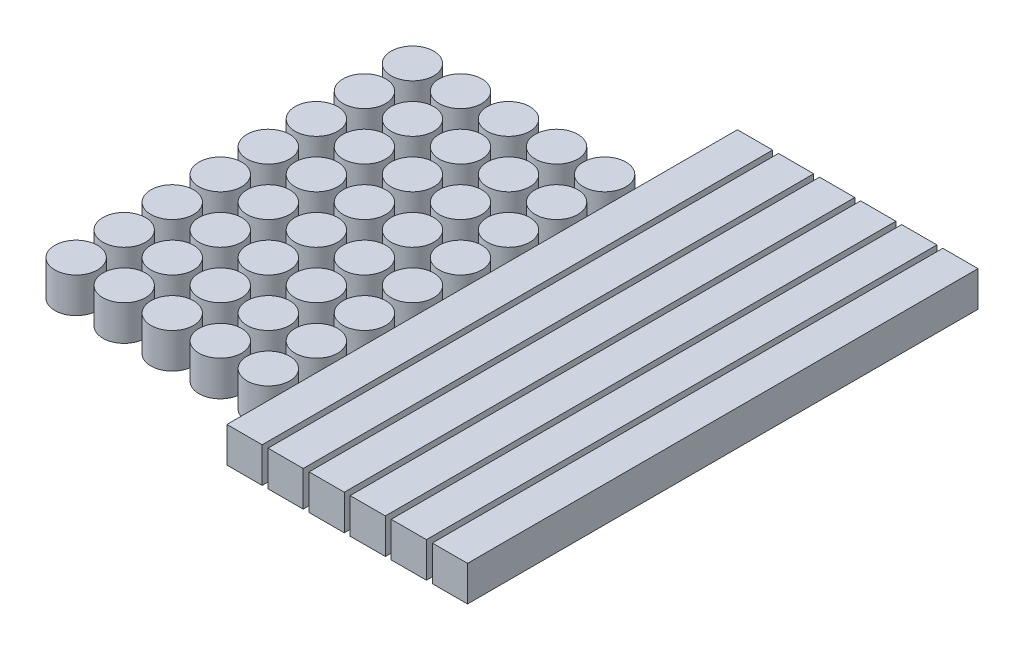
from build123d import *

# Parameters (mm, degrees)
ESBO_O1_R                   = 3.63881204
RESSALTO_EXTRUS_O1_DEPTH    = 6
RESSALTO_EXTRUS_O1_2_DEPTH  = 6
RESSALTO_EXTRUS_O1_3_DEPTH  = 6
RESSALTO_EXTRUS_O1_4_DEPTH  = 6
RESSALTO_EXTRUS_O1_5_DEPTH  = 6
RESSALTO_EXTRUS_O1_6_DEPTH  = 6
RESSALTO_EXTRUS_O1_7_DEPTH  = 6
RESSALTO_EXTRUS_O1_8_DEPTH  = 6
RESSALTO_EXTRUS_O1_9_DEPTH  = 6
RESSALTO_EXTRUS_O1_10_DEPTH = 6
RESSALTO_EXTRUS_O1_11_DEPTH = 6
RESSALTO_EXTRUS_O1_12_DEPTH = 6
RESSALTO_EXTRUS_O1_13_DEPTH = 6
RESSALTO_EXTRUS_O1_14_DEPTH = 6
RESSALTO_EXTRUS_O1_15_DEPTH = 6
RESSALTO_EXTRUS_O1_16_DEPTH = 6
RESSALTO_EXTRUS_O1_17_DEPTH = 6
RESSALTO_EXTRUS_O1_18_DEPTH = 6
RESSALTO_EXTRUS_O1_19_DEPTH = 6
RESSALTO_EXTRUS_O1_20_DEPTH = 6
RESSALTO_EXTRUS_O1_21_DEPTH = 6
RESSALTO_EXTRUS_O1_22_DEPTH = 6
RESSALTO_EXTRUS_O1_23_DEPTH = 6
RESSALTO_EXTRUS_O1_24_DEPTH = 6
RESSALTO_EXTRUS_O1_25_DEPTH = 6
RESSALTO_EXTRUS_O1_26_DEPTH = 6
RESSALTO_EXTRUS_O1_27_DEPTH = 6
RESSALTO_EXTRUS_O1_28_DEPTH = 6
RESSALTO_EXTRUS_O1_29_DEPTH = 6
RESSALTO_EXTRUS_O1_30_DEPTH = 6
RESSALTO_EXTRUS_O1_31_DEPTH = 6
RESSALTO_EXTRUS_O1_32_DEPTH = 6
RESSALTO_EXTRUS_O1_33_DEPTH = 6
RESSALTO_EXTRUS_O1_34_DEPTH = 6
RESSALTO_EXTRUS_O1_35_DEPTH = 6
RESSALTO_EXTRUS_O1_36_DEPTH = 6
RESSALTO_EXTRUS_O1_37_DEPTH = 6
RESSALTO_EXTRUS_O1_38_DEPTH = 6
RESSALTO_EXTRUS_O1_39_DEPTH = 6
RESSALTO_EXTRUS_O1_40_DEPTH = 6
ESBO_O1_W                   = 6
ESBO_O1_H                   = 87
RESSALTO_EXTRUS_O1_41_DEPTH = 6
RESSALTO_EXTRUS_O1_42_DEPTH = 6
RESSALTO_EXTRUS_O1_43_DEPTH = 6
RESSALTO_EXTRUS_O1_44_DEPTH = 6
RESSALTO_EXTRUS_O1_45_DEPTH = 6
RESSALTO_EXTRUS_O1_46_DEPTH = 6


with BuildPart() as part:
    # Esboço1 → Ressalto-extrusão1 (new body)
    with BuildSketch(Plane(origin=(0, 0, 0), x_dir=(1, 0, 0), z_dir=(0, 1, 0))):
        with Locations(Location((-30.842256069, 16.789591759, 0), (0, 0, 270))):
            Circle(ESBO_O1_R)
    extrude(amount=RESSALTO_EXTRUS_O1_DEPTH)


with BuildPart() as body_2:
    # Esboço1 → Ressalto-extrus_o1 2 (new body)
    with BuildSketch(Plane(origin=(0, 0, 0), x_dir=(1, 0, 0), z_dir=(0, 1, 0))):
        with Locations(Location((-22.654928979, 16.789591759, 0), (0, 0, 270))):
            Circle(ESBO_O1_R)
    extrude(amount=RESSALTO_EXTRUS_O1_2_DEPTH)


with BuildPart() as body_3:
    # Esboço1 → Ressalto-extrus_o1 3 (new body)
    with BuildSketch(Plane(origin=(0, 0, 0), x_dir=(1, 0, 0), z_dir=(0, 1, 0))):
        with Locations(Location((-14.46760189, 16.789591759, 0), (0, 0, 270))):
            Circle(ESBO_O1_R)
    extrude(amount=RESSALTO_EXTRUS_O1_3_DEPTH)


with BuildPart() as body_4:
    # Esboço1 → Ressalto-extrus_o1 4 (new body)
    with BuildSketch(Plane(origin=(0, 0, 0), x_dir=(1, 0, 0), z_dir=(0, 1, 0))):
        with Locations(Location((-6.280274801, 16.789591759, 0), (0, 0, 270))):
            Circle(ESBO_O1_R)
    extrude(amount=RESSALTO_EXTRUS_O1_4_DEPTH)


with BuildPart() as body_5:
    # Esboço1 → Ressalto-extrus_o1 5 (new body)
    with BuildSketch(Plane(origin=(0, 0, 0), x_dir=(1, 0, 0), z_dir=(0, 1, 0))):
        with Locations(Location((1.907052288, 16.789591759, 0), (0, 0, 270))):
            Circle(ESBO_O1_R)
    extrude(amount=RESSALTO_EXTRUS_O1_5_DEPTH)


with BuildPart() as body_6:
    # Esboço1 → Ressalto-extrus_o1 6 (new body)
    with BuildSketch(Plane(origin=(0, 0, 0), x_dir=(1, 0, 0), z_dir=(0, 1, 0))):
        with Locations(Location((-22.654928979, 24.976918848, 0), (0, 0, 270))):
            Circle(ESBO_O1_R)
    extrude(amount=RESSALTO_EXTRUS_O1_6_DEPTH)


with BuildPart() as body_7:
    # Esboço1 → Ressalto-extrus_o1 7 (new body)
    with BuildSketch(Plane(origin=(0, 0, 0), x_dir=(1, 0, 0), z_dir=(0, 1, 0))):
        with Locations(Location((-14.46760189, 24.976918848, 0), (0, 0, 270))):
            Circle(ESBO_O1_R)
    extrude(amount=RESSALTO_EXTRUS_O1_7_DEPTH)


with BuildPart() as body_8:
    # Esboço1 → Ressalto-extrus_o1 8 (new body)
    with BuildSketch(Plane(origin=(0, 0, 0), x_dir=(1, 0, 0), z_dir=(0, 1, 0))):
        with Locations(Location((-6.280274801, 24.976918848, 0), (0, 0, 270))):
            Circle(ESBO_O1_R)
    extrude(amount=RESSALTO_EXTRUS_O1_8_DEPTH)


with BuildPart() as body_9:
    # Esboço1 → Ressalto-extrus_o1 9 (new body)
    with BuildSketch(Plane(origin=(0, 0, 0), x_dir=(1, 0, 0), z_dir=(0, 1, 0))):
        with Locations(Location((1.907052288, 24.976918848, 0), (0, 0, 270))):
            Circle(ESBO_O1_R)
    extrude(amount=RESSALTO_EXTRUS_O1_9_DEPTH)


with BuildPart() as body_10:
    # Esboço1 → Ressalto-extrus_o1 10 (new body)
    with BuildSketch(Plane(origin=(0, 0, 0), x_dir=(1, 0, 0), z_dir=(0, 1, 0))):
        with Locations(Location((-22.654928979, 33.164245938, 0), (0, 0, 270))):
            Circle(ESBO_O1_R)
    extrude(amount=RESSALTO_EXTRUS_O1_10_DEPTH)


with BuildPart() as body_11:
    # Esboço1 → Ressalto-extrus_o1 11 (new body)
    with BuildSketch(Plane(origin=(0, 0, 0), x_dir=(1, 0, 0), z_dir=(0, 1, 0))):
        with Locations(Location((-14.46760189, 33.164245938, 0), (0, 0, 270))):
            Circle(ESBO_O1_R)
    extrude(amount=RESSALTO_EXTRUS_O1_11_DEPTH)


with BuildPart() as body_12:
    # Esboço1 → Ressalto-extrus_o1 12 (new body)
    with BuildSketch(Plane(origin=(0, 0, 0), x_dir=(1, 0, 0), z_dir=(0, 1, 0))):
        with Locations(Location((-6.280274801, 33.164245938, 0), (0, 0, 270))):
            Circle(ESBO_O1_R)
    extrude(amount=RESSALTO_EXTRUS_O1_12_DEPTH)


with BuildPart() as body_13:
    # Esboço1 → Ressalto-extrus_o1 13 (new body)
    with BuildSketch(Plane(origin=(0, 0, 0), x_dir=(1, 0, 0), z_dir=(0, 1, 0))):
        with Locations(Location((1.907052288, 33.164245938, 0), (0, 0, 270))):
            Circle(ESBO_O1_R)
    extrude(amount=RESSALTO_EXTRUS_O1_13_DEPTH)


with BuildPart() as body_14:
    # Esboço1 → Ressalto-extrus_o1 14 (new body)
    with BuildSketch(Plane(origin=(0, 0, 0), x_dir=(1, 0, 0), z_dir=(0, 1, 0))):
        with Locations(Location((-22.654928979, 41.351573027, 0), (0, 0, 270))):
            Circle(ESBO_O1_R)
    extrude(amount=RESSALTO_EXTRUS_O1_14_DEPTH)


with BuildPart() as body_15:
    # Esboço1 → Ressalto-extrus_o1 15 (new body)
    with BuildSketch(Plane(origin=(0, 0, 0), x_dir=(1, 0, 0), z_dir=(0, 1, 0))):
        with Locations(Location((-14.46760189, 41.351573027, 0), (0, 0, 270))):
            Circle(ESBO_O1_R)
    extrude(amount=RESSALTO_EXTRUS_O1_15_DEPTH)


with BuildPart() as body_16:
    # Esboço1 → Ressalto-extrus_o1 16 (new body)
    with BuildSketch(Plane(origin=(0, 0, 0), x_dir=(1, 0, 0), z_dir=(0, 1, 0))):
        with Locations(Location((-6.280274801, 41.351573027, 0), (0, 0, 270))):
            Circle(ESBO_O1_R)
    extrude(amount=RESSALTO_EXTRUS_O1_16_DEPTH)


with BuildPart() as body_17:
    # Esboço1 → Ressalto-extrus_o1 17 (new body)
    with BuildSketch(Plane(origin=(0, 0, 0), x_dir=(1, 0, 0), z_dir=(0, 1, 0))):
        with Locations(Location((1.907052288, 41.351573027, 0), (0, 0, 270))):
            Circle(ESBO_O1_R)
    extrude(amount=RESSALTO_EXTRUS_O1_17_DEPTH)


with BuildPart() as body_18:
    # Esboço1 → Ressalto-extrus_o1 18 (new body)
    with BuildSketch(Plane(origin=(0, 0, 0), x_dir=(1, 0, 0), z_dir=(0, 1, 0))):
        with Locations(Location((-22.654928979, 49.538900116, 0), (0, 0, 270))):
            Circle(ESBO_O1_R)
    extrude(amount=RESSALTO_EXTRUS_O1_18_DEPTH)


with BuildPart() as body_19:
    # Esboço1 → Ressalto-extrus_o1 19 (new body)
    with BuildSketch(Plane(origin=(0, 0, 0), x_dir=(1, 0, 0), z_dir=(0, 1, 0))):
        with Locations(Location((-14.46760189, 49.538900116, 0), (0, 0, 270))):
            Circle(ESBO_O1_R)
    extrude(amount=RESSALTO_EXTRUS_O1_19_DEPTH)


with BuildPart() as body_20:
    # Esboço1 → Ressalto-extrus_o1 20 (new body)
    with BuildSketch(Plane(origin=(0, 0, 0), x_dir=(1, 0, 0), z_dir=(0, 1, 0))):
        with Locations(Location((-6.280274801, 49.538900116, 0), (0, 0, 270))):
            Circle(ESBO_O1_R)
    extrude(amount=RESSALTO_EXTRUS_O1_20_DEPTH)


with BuildPart() as body_21:
    # Esboço1 → Ressalto-extrus_o1 21 (new body)
    with BuildSketch(Plane(origin=(0, 0, 0), x_dir=(1, 0, 0), z_dir=(0, 1, 0))):
        with Locations(Location((1.907052288, 49.538900116, 0), (0, 0, 270))):
            Circle(ESBO_O1_R)
    extrude(amount=RESSALTO_EXTRUS_O1_21_DEPTH)


with BuildPart() as body_22:
    # Esboço1 → Ressalto-extrus_o1 22 (new body)
    with BuildSketch(Plane(origin=(0, 0, 0), x_dir=(1, 0, 0), z_dir=(0, 1, 0))):
        with Locations(Location((-22.654928979, 57.726227205, 0), (0, 0, 270))):
            Circle(ESBO_O1_R)
    extrude(amount=RESSALTO_EXTRUS_O1_22_DEPTH)


with BuildPart() as body_23:
    # Esboço1 → Ressalto-extrus_o1 23 (new body)
    with BuildSketch(Plane(origin=(0, 0, 0), x_dir=(1, 0, 0), z_dir=(0, 1, 0))):
        with Locations(Location((-14.46760189, 57.726227205, 0), (0, 0, 270))):
            Circle(ESBO_O1_R)
    extrude(amount=RESSALTO_EXTRUS_O1_23_DEPTH)


with BuildPart() as body_24:
    # Esboço1 → Ressalto-extrus_o1 24 (new body)
    with BuildSketch(Plane(origin=(0, 0, 0), x_dir=(1, 0, 0), z_dir=(0, 1, 0))):
        with Locations(Location((-6.280274801, 57.726227205, 0), (0, 0, 270))):
            Circle(ESBO_O1_R)
    extrude(amount=RESSALTO_EXTRUS_O1_24_DEPTH)


with BuildPart() as body_25:
    # Esboço1 → Ressalto-extrus_o1 25 (new body)
    with BuildSketch(Plane(origin=(0, 0, 0), x_dir=(1, 0, 0), z_dir=(0, 1, 0))):
        with Locations(Location((1.907052288, 57.726227205, 0), (0, 0, 270))):
            Circle(ESBO_O1_R)
    extrude(amount=RESSALTO_EXTRUS_O1_25_DEPTH)


with BuildPart() as body_26:
    # Esboço1 → Ressalto-extrus_o1 26 (new body)
    with BuildSketch(Plane(origin=(0, 0, 0), x_dir=(1, 0, 0), z_dir=(0, 1, 0))):
        with Locations(Location((-22.654928979, 65.913554294, 0), (0, 0, 270))):
            Circle(ESBO_O1_R)
    extrude(amount=RESSALTO_EXTRUS_O1_26_DEPTH)


with BuildPart() as body_27:
    # Esboço1 → Ressalto-extrus_o1 27 (new body)
    with BuildSketch(Plane(origin=(0, 0, 0), x_dir=(1, 0, 0), z_dir=(0, 1, 0))):
        with Locations(Location((-14.46760189, 65.913554294, 0), (0, 0, 270))):
            Circle(ESBO_O1_R)
    extrude(amount=RESSALTO_EXTRUS_O1_27_DEPTH)


with BuildPart() as body_28:
    # Esboço1 → Ressalto-extrus_o1 28 (new body)
    with BuildSketch(Plane(origin=(0, 0, 0), x_dir=(1, 0, 0), z_dir=(0, 1, 0))):
        with Locations(Location((-6.280274801, 65.913554294, 0), (0, 0, 270))):
            Circle(ESBO_O1_R)
    extrude(amount=RESSALTO_EXTRUS_O1_28_DEPTH)


with BuildPart() as body_29:
    # Esboço1 → Ressalto-extrus_o1 29 (new body)
    with BuildSketch(Plane(origin=(0, 0, 0), x_dir=(1, 0, 0), z_dir=(0, 1, 0))):
        with Locations(Location((1.907052288, 65.913554294, 0), (0, 0, 270))):
            Circle(ESBO_O1_R)
    extrude(amount=RESSALTO_EXTRUS_O1_29_DEPTH)


with BuildPart() as body_30:
    # Esboço1 → Ressalto-extrus_o1 30 (new body)
    with BuildSketch(Plane(origin=(0, 0, 0), x_dir=(1, 0, 0), z_dir=(0, 1, 0))):
        with Locations(Location((-22.654928979, 74.100881384, 0), (0, 0, 270))):
            Circle(ESBO_O1_R)
    extrude(amount=RESSALTO_EXTRUS_O1_30_DEPTH)


with BuildPart() as body_31:
    # Esboço1 → Ressalto-extrus_o1 31 (new body)
    with BuildSketch(Plane(origin=(0, 0, 0), x_dir=(1, 0, 0), z_dir=(0, 1, 0))):
        with Locations(Location((-14.46760189, 74.100881384, 0), (0, 0, 270))):
            Circle(ESBO_O1_R)
    extrude(amount=RESSALTO_EXTRUS_O1_31_DEPTH)


with BuildPart() as body_32:
    # Esboço1 → Ressalto-extrus_o1 32 (new body)
    with BuildSketch(Plane(origin=(0, 0, 0), x_dir=(1, 0, 0), z_dir=(0, 1, 0))):
        with Locations(Location((-6.280274801, 74.100881384, 0), (0, 0, 270))):
            Circle(ESBO_O1_R)
    extrude(amount=RESSALTO_EXTRUS_O1_32_DEPTH)


with BuildPart() as body_33:
    # Esboço1 → Ressalto-extrus_o1 33 (new body)
    with BuildSketch(Plane(origin=(0, 0, 0), x_dir=(1, 0, 0), z_dir=(0, 1, 0))):
        with Locations(Location((1.907052288, 74.100881384, 0), (0, 0, 270))):
            Circle(ESBO_O1_R)
    extrude(amount=RESSALTO_EXTRUS_O1_33_DEPTH)


with BuildPart() as body_34:
    # Esboço1 → Ressalto-extrus_o1 34 (new body)
    with BuildSketch(Plane(origin=(0, 0, 0), x_dir=(1, 0, 0), z_dir=(0, 1, 0))):
        with Locations(Location((-30.842256069, 24.976918848, 0), (0, 0, 270))):
            Circle(ESBO_O1_R)
    extrude(amount=RESSALTO_EXTRUS_O1_34_DEPTH)


with BuildPart() as body_35:
    # Esboço1 → Ressalto-extrus_o1 35 (new body)
    with BuildSketch(Plane(origin=(0, 0, 0), x_dir=(1, 0, 0), z_dir=(0, 1, 0))):
        with Locations(Location((-30.842256069, 33.164245938, 0), (0, 0, 270))):
            Circle(ESBO_O1_R)
    extrude(amount=RESSALTO_EXTRUS_O1_35_DEPTH)


with BuildPart() as body_36:
    # Esboço1 → Ressalto-extrus_o1 36 (new body)
    with BuildSketch(Plane(origin=(0, 0, 0), x_dir=(1, 0, 0), z_dir=(0, 1, 0))):
        with Locations(Location((-30.842256069, 41.351573027, 0), (0, 0, 270))):
            Circle(ESBO_O1_R)
    extrude(amount=RESSALTO_EXTRUS_O1_36_DEPTH)


with BuildPart() as body_37:
    # Esboço1 → Ressalto-extrus_o1 37 (new body)
    with BuildSketch(Plane(origin=(0, 0, 0), x_dir=(1, 0, 0), z_dir=(0, 1, 0))):
        with Locations(Location((-30.842256069, 49.538900116, 0), (0, 0, 270))):
            Circle(ESBO_O1_R)
    extrude(amount=RESSALTO_EXTRUS_O1_37_DEPTH)


with BuildPart() as body_38:
    # Esboço1 → Ressalto-extrus_o1 38 (new body)
    with BuildSketch(Plane(origin=(0, 0, 0), x_dir=(1, 0, 0), z_dir=(0, 1, 0))):
        with Locations(Location((-30.842256069, 57.726227205, 0), (0, 0, 270))):
            Circle(ESBO_O1_R)
    extrude(amount=RESSALTO_EXTRUS_O1_38_DEPTH)


with BuildPart() as body_39:
    # Esboço1 → Ressalto-extrus_o1 39 (new body)
    with BuildSketch(Plane(origin=(0, 0, 0), x_dir=(1, 0, 0), z_dir=(0, 1, 0))):
        with Locations(Location((-30.842256069, 65.913554294, 0), (0, 0, 270))):
            Circle(ESBO_O1_R)
    extrude(amount=RESSALTO_EXTRUS_O1_39_DEPTH)


with BuildPart() as body_40:
    # Esboço1 → Ressalto-extrus_o1 40 (new body)
    with BuildSketch(Plane(origin=(0, 0, 0), x_dir=(1, 0, 0), z_dir=(0, 1, 0))):
        with Locations(Location((-30.842256069, 74.100881384, 0), (0, 0, 270))):
            Circle(ESBO_O1_R)
    extrude(amount=RESSALTO_EXTRUS_O1_40_DEPTH)


with BuildPart() as body_41:
    # Esboço1 → Ressalto-extrus_o1 41 (new body)
    with BuildSketch(Plane(origin=(0, 0, 0), x_dir=(1, 0, 0), z_dir=(0, 1, 0))):
        with Locations((16.632003209, 48.5109107)):
            Rectangle(ESBO_O1_W, ESBO_O1_H)
    extrude(amount=RESSALTO_EXTRUS_O1_41_DEPTH)


with BuildPart() as body_42:
    # Esboço1 → Ressalto-extrus_o1 42 (new body)
    with BuildSketch(Plane(origin=(0, 0, 0), x_dir=(1, 0, 0), z_dir=(0, 1, 0))):
        with Locations((9.632003209, 48.5109107)):
            Rectangle(ESBO_O1_W, ESBO_O1_H)
    extrude(amount=RESSALTO_EXTRUS_O1_42_DEPTH)


with BuildPart() as body_43:
    # Esboço1 → Ressalto-extrus_o1 43 (new body)
    with BuildSketch(Plane(origin=(0, 0, 0), x_dir=(1, 0, 0), z_dir=(0, 1, 0))):
        with Locations((23.632003209, 48.5109107)):
            Rectangle(ESBO_O1_W, ESBO_O1_H)
    extrude(amount=RESSALTO_EXTRUS_O1_43_DEPTH)


with BuildPart() as body_44:
    # Esboço1 → Ressalto-extrus_o1 44 (new body)
    with BuildSketch(Plane(origin=(0, 0, 0), x_dir=(1, 0, 0), z_dir=(0, 1, 0))):
        with Locations((30.632003209, 48.5109107)):
            Rectangle(ESBO_O1_W, ESBO_O1_H)
    extrude(amount=RESSALTO_EXTRUS_O1_44_DEPTH)


with BuildPart() as body_45:
    # Esboço1 → Ressalto-extrus_o1 45 (new body)
    with BuildSketch(Plane(origin=(0, 0, 0), x_dir=(1, 0, 0), z_dir=(0, 1, 0))):
        with Locations((37.632003209, 48.5109107)):
            Rectangle(ESBO_O1_W, ESBO_O1_H)
    extrude(amount=RESSALTO_EXTRUS_O1_45_DEPTH)


with BuildPart() as body_46:
    # Esboço1 → Ressalto-extrus_o1 46 (new body)
    with BuildSketch(Plane(origin=(0, 0, 0), x_dir=(1, 0, 0), z_dir=(0, 1, 0))):
        with Locations((44.632003209, 48.5109107)):
            Rectangle(ESBO_O1_W, ESBO_O1_H)
    extrude(amount=RESSALTO_EXTRUS_O1_46_DEPTH)


solid = Compound([part.part, body_2.part, body_3.part, body_4.part, body_5.part, body_6.part, body_7.part, body_8.part, body_9.part, body_10.part, body_11.part, body_12.part, body_13.part, body_14.part, body_15.part, body_16.part, body_17.part, body_18.part, body_19.part, body_20.part, body_21.part, body_22.part, body_23.part, body_24.part, body_25.part, body_26.part, body_27.part, body_28.part, body_29.part, body_30.part, body_31.part, body_32.part, body_33.part, body_34.part, body_35.part, body_36.part, body_37.part, body_38.part, body_39.part, body_40.part, body_41.part, body_42.part, body_43.part, body_44.part, body_45.part, body_46.part])
